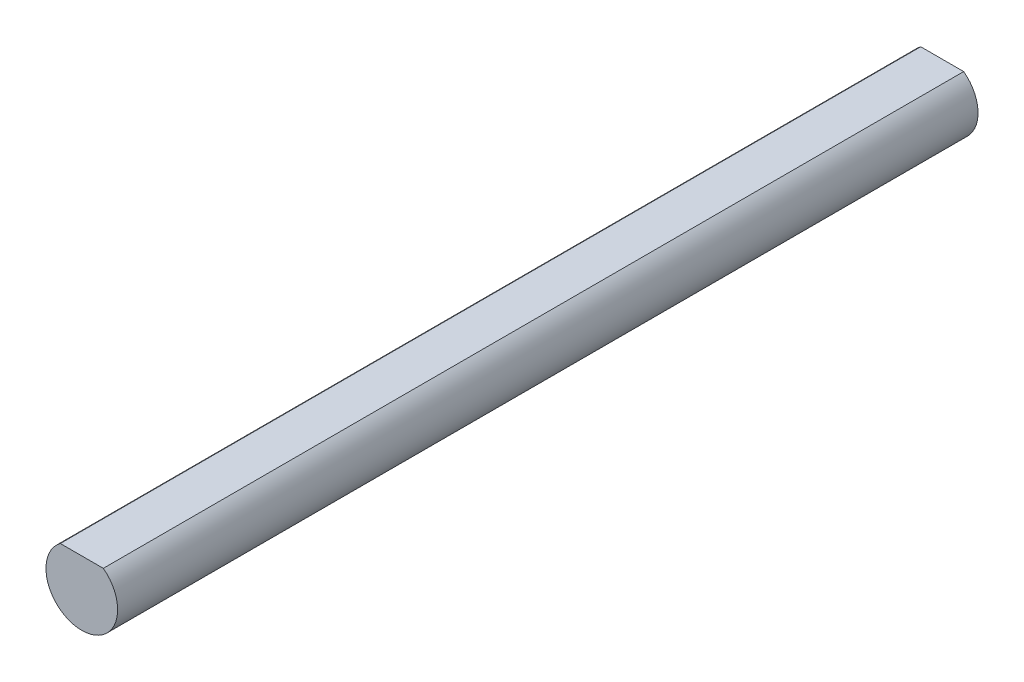
from build123d import *

# Parameters (mm, degrees)
BOSS_EXTRU_1_DEPTH = 76.2


with BuildPart() as part:
    # Esquisse2 → Boss.-Extru.1 (new body)
    with BuildSketch(Plane.XY):
        with BuildLine():
            Line((-1.905, 2.54), (1.905, 2.54))
            ThreePointArc((1.905, 2.54), (0, -3.175), (-1.905, 2.54))
        make_face()
    extrude(amount=BOSS_EXTRU_1_DEPTH)


solid = part.part
